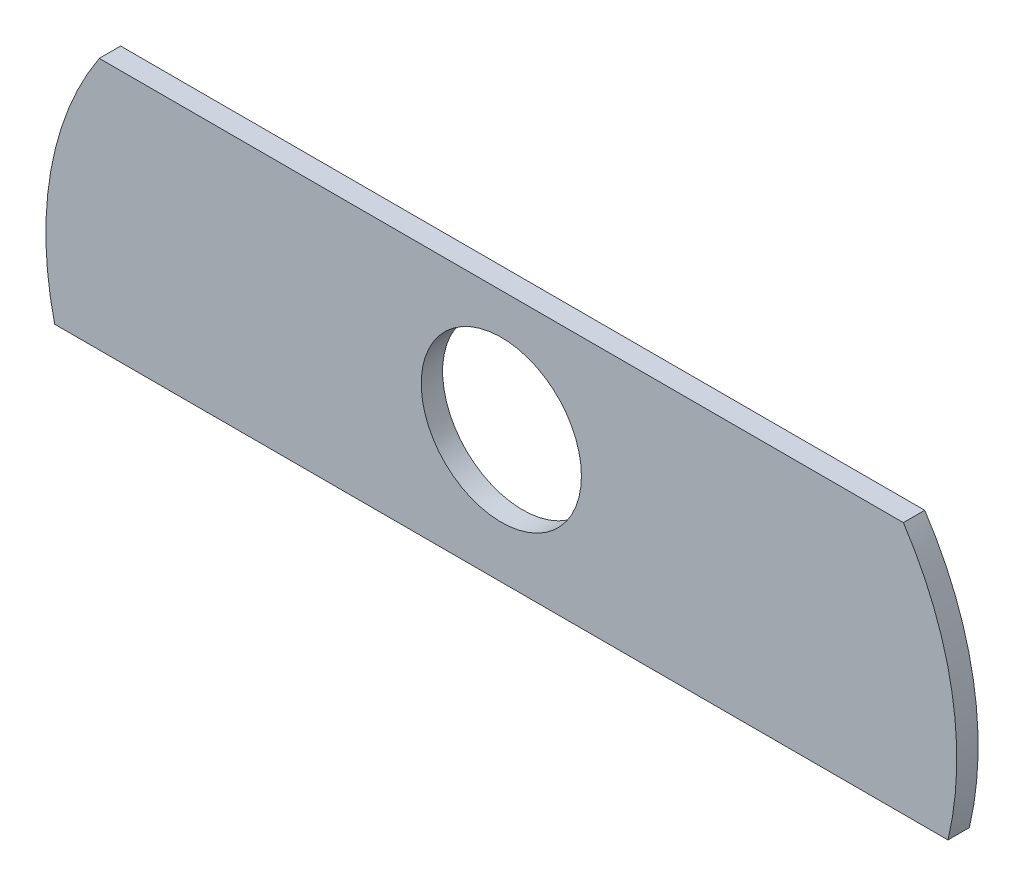
from build123d import *

# Parameters (mm, degrees)
BOSS_EXTRUDE1_DEPTH = 2
SKETCH6_R           = 7.5
CUT_EXTRUDE1_DEPTH  = 2
SKETCH7_W           = 96.175516813
SKETCH7_H           = 15.621463592
CUT_EXTRUDE2_DEPTH  = 2


with BuildPart() as part:
    # Sketch5 → Boss-Extrude1 (new body)
    with BuildSketch(Plane.XY):
        with BuildLine():
            Line((-37.65, 16.64), (37.65, 16.64))
            ThreePointArc((37.65, 16.64), (42.65, 0), (37.65, -16.64))
            Line((37.65, -16.64), (-37.65, -16.64))
            ThreePointArc((-37.65, -16.64), (-42.65, 0), (-37.65, 16.64))
        make_face()
    extrude(amount=BOSS_EXTRUDE1_DEPTH)

    # Sketch6 → Cut-Extrude1 (cut)
    with BuildSketch(Plane.XY.offset(2)):
        with Locations((0, 5.34)):
            Circle(SKETCH6_R)
    extrude(amount=-CUT_EXTRUDE1_DEPTH, mode=Mode.SUBTRACT)

    # Sketch7 → Cut-Extrude2 (cut)
    with BuildSketch(Plane.XY.offset(2)):
        with Locations((0.470526011, -14.821569372)):
            Rectangle(SKETCH7_W, SKETCH7_H)
    extrude(amount=-CUT_EXTRUDE2_DEPTH, mode=Mode.SUBTRACT)


solid = part.part
